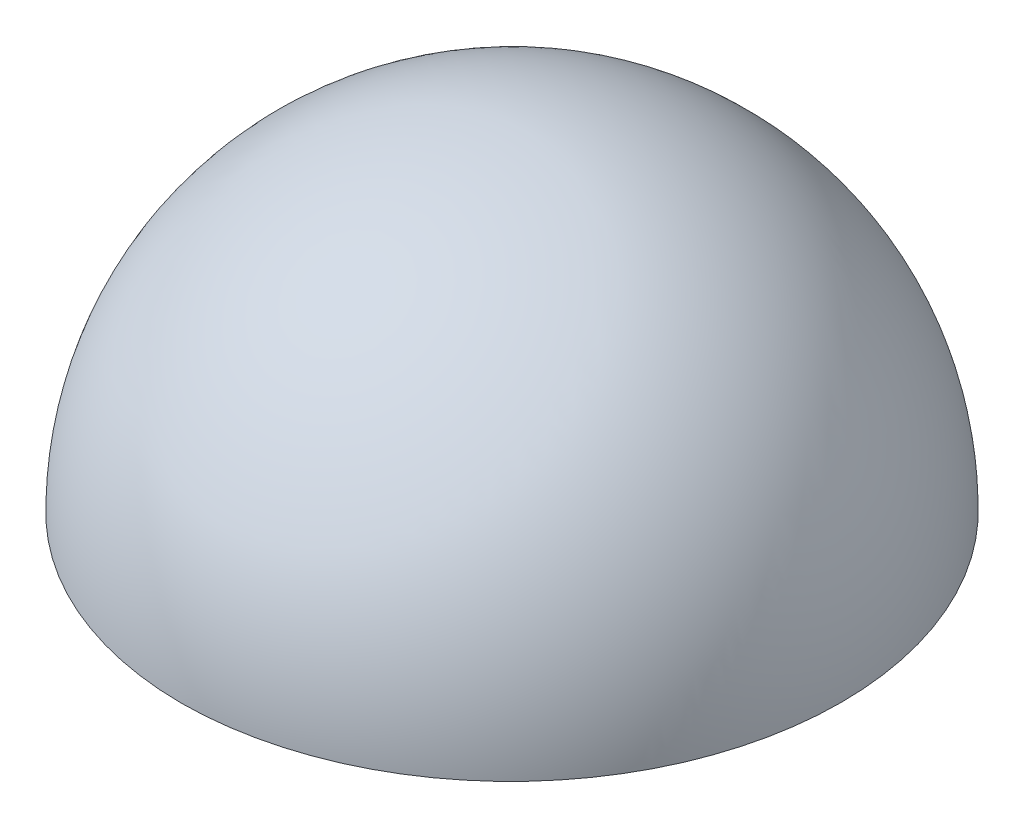
from build123d import *

# Parameters (mm, degrees)
REVOLVE3_ANGLE = 180


with BuildPart() as part:
    # Sketch1 → Revolve3 (revolve)
    with BuildSketch(Plane(origin=(0, 0, 0), x_dir=(1, 0, 0), z_dir=(0, 1, 0))):
        with BuildLine():
            Line((0.077086583, 37.221932116), (0.077086583, 35.280756702))
            ThreePointArc((0.077086583, 35.280756702), (34.921761214, 0.281101361), (0.077086583, -34.718553981))
            Line((0.077086583, -34.718553981), (0.077086583, -36.777415828))
            ThreePointArc((0.077086583, -36.777415828), (36.921761214, 0.222258144), (0.077086583, 37.221932116))
        make_face()
    revolve(axis=Axis((0.077086583, 0, -37.221932116), (0, 0, 1)), revolution_arc=REVOLVE3_ANGLE)


solid = part.part
